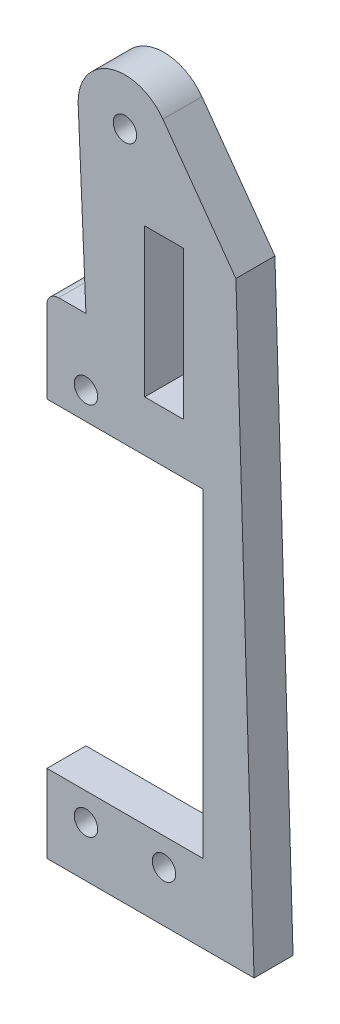
from build123d import *

# Parameters (mm, degrees)
ESQUISSE1_R        = 1.5
ESQUISSE1_W        = 5
ESQUISSE1_H        = 19
BOSS_EXTRU_1_DEPTH = 5
CONG_3_R           = 1.5


with BuildPart() as part:
    # Esquisse1 → Boss.-Extru.1 (new body)
    with BuildSketch(Plane.XY):
        with BuildLine():
            Line((0, 10), (0, 0))
            Line((0, 0), (26.554131445, 0))
            Line((26.554131445, 0), (24.226405413, 76.5))
            Line((24.226405413, 76.5), (14.870448313, 89.504102342))
            ThreePointArc((14.870448313, 89.504102342), (8.034842814, 91.669052587), (4.005728082, 85.7378852))
            Line((4.005728082, 85.7378852), (5, 63))
            Line((5, 63), (0, 63))
            Line((0, 63), (0, 51))
            Line((0, 51), (11, 51))
            Line((11, 51), (20, 51))
            Line((20, 51), (20, 10))
            Line((20, 10), (11, 10))
            Line((11, 10), (0, 10))
        make_face()
        with Locations((5, 54.5)):
            Circle(ESQUISSE1_R, mode=Mode.SUBTRACT)
        with Locations((15, 6.5)):
            Circle(ESQUISSE1_R, mode=Mode.SUBTRACT)
        with Locations((5, 6.5)):
            Circle(ESQUISSE1_R, mode=Mode.SUBTRACT)
        with Locations((10, 86)):
            Circle(ESQUISSE1_R, mode=Mode.SUBTRACT)
        with Locations((15.02885683, 67)):
            Rectangle(ESQUISSE1_W, ESQUISSE1_H, mode=Mode.SUBTRACT)
    extrude(amount=BOSS_EXTRU_1_DEPTH)

    # Congé3
    cong_3_edges = [part.edges().sort_by_distance(p)[0] for p in [
        (0, 63, 2.5),
    ]]
    fillet(cong_3_edges, radius=CONG_3_R)


solid = part.part
